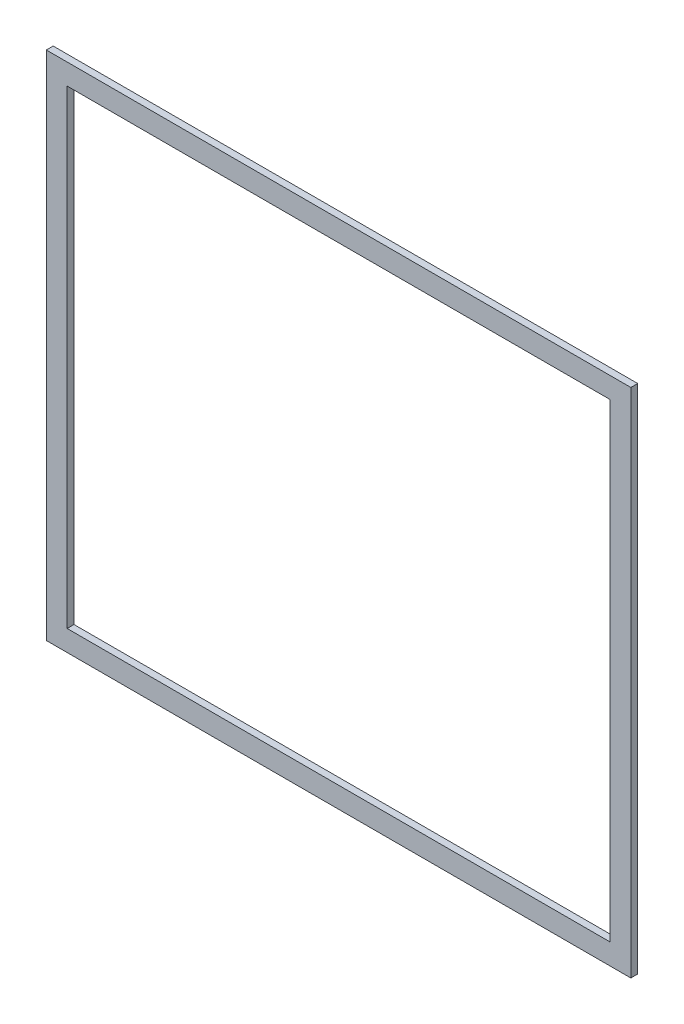
from build123d import *

# Parameters (mm, degrees)
SKETCH2_W = 2.3876
SKETCH2_H = 7.239


with BuildPart() as part:
    # Sweep1: sweep along a path in Sketch1
    with BuildLine(Plane.XY) as sweep1_path:
        Line((-97.917, 85.217), (97.917, 85.217))
        Line((97.917, 85.217), (97.917, -85.217))
        Line((97.917, -85.217), (-97.917, -85.217))
        Line((-97.917, -85.217), (-97.917, 85.217))
    # Sketch2 → Sweep1 (sweep)
    with BuildSketch(Plane(origin=(0, 0, 0), x_dir=(0, 0, -1), z_dir=(1, 0, 0))):
        with Locations((-1.1938, 85.217)):
            Rectangle(SKETCH2_W, SKETCH2_H)
    sweep(path=sweep1_path.line, transition=Transition.RIGHT)


solid = part.part
